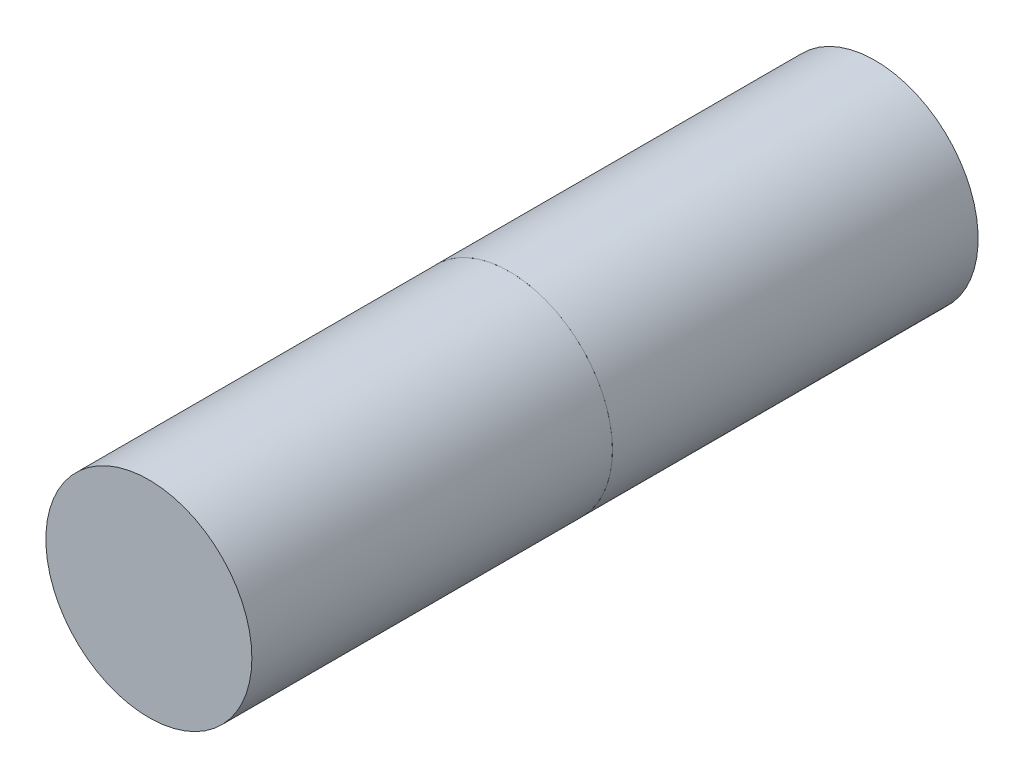
from build123d import *

# Parameters (mm, degrees)
SKETCH_1_R      = 2
EXTRUDE_1_DEPTH = 7
SKETCH_2_R      = 2
EXTRUDE_2_DEPTH = 7.1


with BuildPart() as part:
    # 草图1 → 凸台-拉伸1 (new body)
    with BuildSketch(Plane.XY):
        Circle(SKETCH_1_R)
    extrude(amount=EXTRUDE_1_DEPTH)


with BuildPart() as body_2:
    # 草图2 → 凸台-拉伸2 (new body)
    with BuildSketch(Plane(origin=(0, 0, 0), x_dir=(-1, 0, 0), z_dir=(0, 0, -1))):
        Circle(SKETCH_2_R)
    extrude(amount=EXTRUDE_2_DEPTH)


solid = Compound([part.part, body_2.part])
